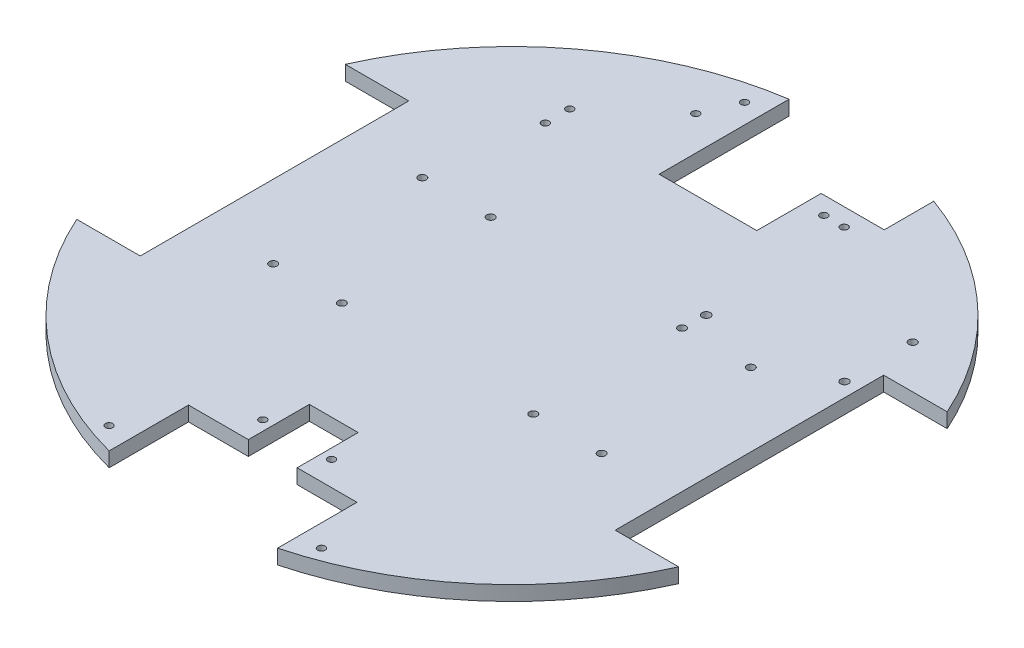
from build123d import *

# Parameters (mm, degrees)
ESQUISSE1_R                   = 135
BOSS_EXTRU_1_DEPTH            = 6
ESQUISSE2_W                   = 112.183682252
ESQUISSE2_H                   = 110
ESQUISSE2_W_2                 = 110.90382882
ENL_V_MAT_EXTRU_12_DEPTH      = 10
ENL_V_MAT_EXTRU_13_DEPTH      = 183.92348127
ENL_V_MAT_EXTRU_14_DEPTH      = 182.826840703
ENL_V_MAT_EXTRU_14_DEPTH_BACK = 182.826840703
ESQUISSE4_R                   = 1.653250653
ESQUISSE4_R_2                 = 1.624051272
ESQUISSE4_R_3                 = 1.712018077
ESQUISSE4_R_4                 = 1.6
ESQUISSE4_R_5                 = 1.599999728
ESQUISSE4_R_6                 = 1.599999892
ESQUISSE4_R_7                 = 1.599999865
ESQUISSE4_R_8                 = 1.599999855
ESQUISSE4_R_9                 = 1.5


with BuildPart() as part:
    # Esquisse1 → Boss.-Extru.1 (new body)
    with BuildSketch(Plane(origin=(0, 0, 0), x_dir=(1, 0, 0), z_dir=(0, 1, 0))):
        with Locations(Location((0, 0, 0), (0, 0, 270))):
            Circle(ESQUISSE1_R)
    extrude(amount=BOSS_EXTRU_1_DEPTH)

    # Esquisse2 → Enlèv. mat.-Extru.12 (cut)
    with BuildSketch(Plane(origin=(0, 6, 0), x_dir=(1, 0, 0), z_dir=(0, 1, 0))):
        with Locations((153.380121185, 0)):
            Rectangle(ESQUISSE2_W, ESQUISSE2_H)
        with Locations((-152.740194469, 0)):
            Rectangle(ESQUISSE2_W_2, ESQUISSE2_H)
    extrude(amount=-ENL_V_MAT_EXTRU_12_DEPTH, mode=Mode.SUBTRACT)

    # Esquisse3 → Enlèv. mat.-Extru.13 (cut, through all)
    with BuildSketch(Plane(origin=(0, 6, 0), x_dir=(1, 0, 0), z_dir=(0, 1, 0))):
        with BuildLine():
            Line((45.835319933, 106.66240667), (45.835319933, 126.980799519))
            ThreePointArc((45.835319933, 126.980799519), (23.265769543, 132.980088613), (0, 135))
            ThreePointArc((0, 135), (-10.027701736, 134.627059679), (-20, 133.510299228))
            Line((-20, 133.510299228), (-20, 80.28740667))
            Line((-20, 80.28740667), (20, 80.28740667))
            Line((20, 80.28740667), (20, 106.66240667))
            Line((20, 106.66240667), (45.835319933, 106.66240667))
        make_face()
        with BuildLine():
            Line((34.5, -98), (10, -98))
            Line((10, -98), (10, -73))
            Line((10, -73), (-10, -73))
            Line((-10, -73), (-10, -98))
            Line((-10, -98), (-34.5, -98))
            Line((-34.5, -98), (-34.5, -130.517240241))
            ThreePointArc((-34.5, -130.517240241), (-17.395007438, -133.874619388), (0, -135))
            ThreePointArc((0, -135), (17.395007438, -133.874619388), (34.5, -130.517240241))
            Line((34.5, -130.517240241), (34.5, -98))
        make_face()
    extrude(amount=-ENL_V_MAT_EXTRU_13_DEPTH, mode=Mode.SUBTRACT)

    # Esquisse4 → Enlèv. mat.-Extru.14 (cut, two sides: drawn at the far end of the back side and taken through both)
    with BuildSketch(Plane(origin=(0, 6, 0), x_dir=(1, 0, 0), z_dir=(0, 1, 0)).offset(-ENL_V_MAT_EXTRU_14_DEPTH_BACK)):
        with Locations(Location((91.525914299, 44.710203818, 0), (0, 0, 270))):
            Circle(ESQUISSE4_R)
        with Locations(Location((91.529697638, 72.638042273, 0), (0, 0, 270))):
            Circle(ESQUISSE4_R_2)
        with Locations(Location((39.606920151, 39.974167075, 0), (0, 0, 270))):
            Circle(ESQUISSE4_R_3)
        with Locations(Location((67.288280059, 30.548697725, 0), (0, 0, 270))):
            Circle(ESQUISSE4_R_4)
        with Locations(Location((39.288280059, 30.412294197, 0), (0, 0, 270))):
            Circle(ESQUISSE4_R_4)
        with Locations(Location((39.288280059, -30.547108673, 0), (0, 0, 270))):
            Circle(ESQUISSE4_R_5)
        with Locations(Location((67.288280059, -30.547108757, 0), (0, 0, 270))):
            Circle(ESQUISSE4_R_6)
        with Locations(Location((-39.288280059, -30.412294197, 0), (0, 0, 270))):
            Circle(ESQUISSE4_R_4)
        with Locations(Location((-67.288280059, -30.548697725, 0), (0, 0, 270))):
            Circle(ESQUISSE4_R_4)
        with Locations(Location((-67.288280059, 30.547108757, 0), (0, 0, 270))):
            Circle(ESQUISSE4_R_7)
        with Locations(Location((-39.288280059, 30.547108674, 0), (0, 0, 270))):
            Circle(ESQUISSE4_R_8)
        with Locations(Location((-61.462852102, 85.131040367, 0), (0, 0, 270))):
            Circle(ESQUISSE4_R_9)
        with Locations(Location((-61.462852102, 75.131040367, 0), (0, 0, 270))):
            Circle(ESQUISSE4_R_9)
        with Locations(Location((-28, 123.28740667, 0), (0, 0, 270))):
            Circle(ESQUISSE4_R_9)
        with Locations(Location((-34, 109.28740667, 0), (0, 0, 270))):
            Circle(ESQUISSE4_R_9)
        with Locations(Location((28.333333333, 99.41740667, 0), (0, 0, 270))):
            Circle(ESQUISSE4_R_9)
        with Locations(Location((36.666666667, 99.41740667, 0), (0, 0, 270))):
            Circle(ESQUISSE4_R_9)
        with Locations(Location((43.5, -121.562248636, 0), (0, 0, 270))):
            Circle(ESQUISSE4_R_9)
        with Locations(Location((-43.5, -121.562248636, 0), (0, 0, 270))):
            Circle(ESQUISSE4_R_9)
        with Locations(Location((14.08, -88, 0), (0, 0, 270))):
            Circle(ESQUISSE4_R_9)
        with Locations(Location((-14.07013432, -88, 0), (0, 0, 270))):
            Circle(ESQUISSE4_R_9)
    extrude(amount=ENL_V_MAT_EXTRU_14_DEPTH + ENL_V_MAT_EXTRU_14_DEPTH_BACK, mode=Mode.SUBTRACT)


solid = part.part
